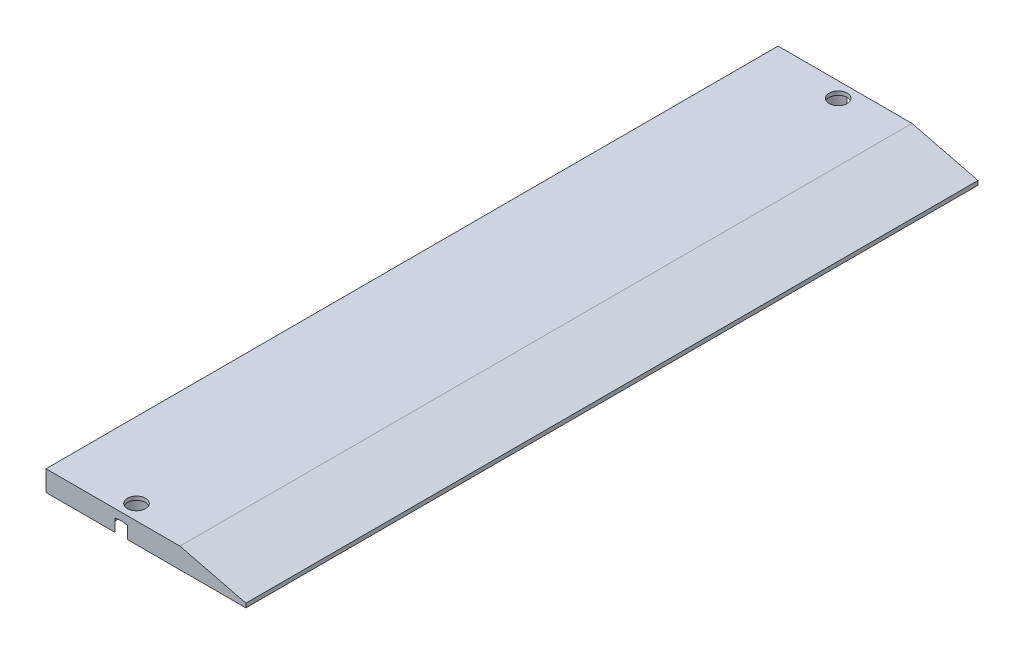
from build123d import *

# Parameters (mm, degrees)
BOSS_EXTRUDE1_DEPTH = 44.5
HOLEWZD2_AT_2_COUNT = 2
HOLEWZD2_AT_2_PITCH = 85.3


with BuildPart() as part:
    # Sketch1 → Boss-Extrude1 (new, symmetric)
    with BuildSketch(Plane.XY):
        Polygon((0, 0), (0, 2.5), (16.278438133, 2.5), (24.3, 0.5), (24.3, 0), align=None)
    extrude(amount=BOSS_EXTRUDE1_DEPTH, both=True)

    # Sketch6 → HoleWzd2 (revolve, cut)
    with BuildSketch(Plane(origin=(9.15, 0, 42.65), x_dir=(0, 0, -1), z_dir=(1, 0, 0))):
        Polygon((0, 0), (0, 2.5), (1.1, 2.5), (1.1, 2.040774557), (2, 1.5), (2, 0), align=None)
    holewzd2 = revolve(axis=Axis((9.15, -6.130023899, 42.65), (0, 1, 0)), mode=Mode.SUBTRACT)

    # HoleWzd2 at 2: HoleWzd2 ×2
    with Locations(*[(0, 0, -i * HOLEWZD2_AT_2_PITCH) for i in range(1, HOLEWZD2_AT_2_COUNT)]):
        add(holewzd2, mode=Mode.SUBTRACT)


solid = part.part
